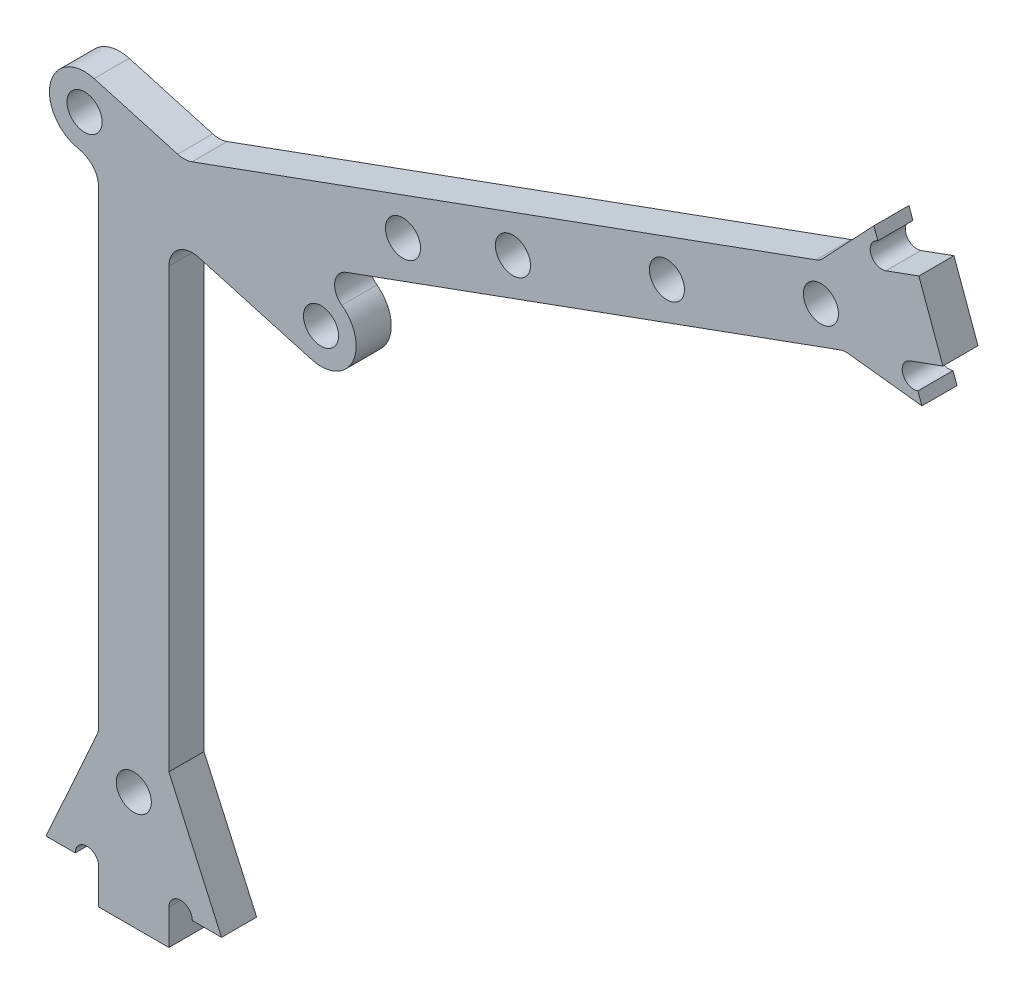
from build123d import *

# Parameters (mm, degrees)
SKETCH_1_R          = 1.5
EXTRUDE_1_DEPTH     = 3
FILLET_1_R          = 2
FILLET_2_R          = 1.5
EXTRUDE_2_DEPTH     = 3
CUT_EXTRUDE_2_DEPTH = 10
EXTRUDE_3_DEPTH     = 3
FILLET_4_R          = 1.5
SKETCH_8_R          = 1.5
CUT_EXTRUDE_3_DEPTH = 3
SKETCH_9_R          = 1
CUT_EXTRUDE_4_DEPTH = 10
SKETCH_10_R         = 1.5
CUT_EXTRUDE_5_DEPTH = 10
SKETCH_11_R         = 1.5
CUT_EXTRUDE_6_DEPTH = 75.756148202


with BuildPart() as part:
    # 草图1 → 凸台-拉伸1 (new body)
    with BuildSketch(Plane.XY):
        with BuildLine():
            ThreePointArc((-0.817087424, -2.886584165), (2.886584165, -0.817087424), (0.817087424, 2.886584165))
            Line((0.817087424, 2.886584165), (-1.760091504, 3.616090173))
            Line((-1.760091504, 3.616090173), (64.410402882, 27.700180516))
            Line((64.410402882, 27.700180516), (62.358282022, 33.338336241))
            Line((62.358282022, 33.338336241), (-11.628300128, 6.409422603))
            Line((-11.628300128, 6.409422603), (-19.389001732, 8.606196131))
            ThreePointArc((-19.389001732, 8.606196131), (-23.09267332, 6.53669939), (-21.023176579, 2.833027801))
            Line((-21.023176579, 2.833027801), (-19, 2.260339792))
            Line((-19, 2.260339792), (-19, -52.5))
            Line((-19, -52.5), (-13, -52.5))
            Line((-13, -52.5), (-13, 0.561957115))
            Line((-13, 0.561957115), (-0.817087424, -2.886584165))
        make_face()
        with Locations((-20.206089155, 5.719611966)):
            Circle(SKETCH_1_R, mode=Mode.SUBTRACT)
        Circle(SKETCH_1_R, mode=Mode.SUBTRACT)
    extrude(amount=EXTRUDE_1_DEPTH)

    # 圆角1
    fillet_1_edges = [part.edges().sort_by_distance(p)[0] for p in [
        (-11.628300128, 6.409422603, 1.5),
        (-13, 0.561957115, 1.5),
        (-19, 2.260339792, 1.5),
    ]]
    fillet(fillet_1_edges, radius=FILLET_1_R)

    # 圆角2
    fillet_2_edges = [part.edges().sort_by_distance(p)[0] for p in [
        (-1.760091504, 3.616090173, 1.5),
    ]]
    fillet(fillet_2_edges, radius=FILLET_2_R)

    # 草图3 → 凸台-拉伸2 (add)
    with BuildSketch(Plane.XY.offset(3)):
        with BuildLine():
            Line((-21, -49.5), (-23.5, -49.5))
            Line((-23.5, -49.5), (-19, -39.5))
            Line((-19, -39.5), (-19, -49.5))
            ThreePointArc((-19, -49.5), (-20, -48.5), (-21, -49.5))
        make_face()
        with BuildLine():
            Line((-13, -49.5), (-13, -39.5))
            Line((-13, -39.5), (-8.5, -49.5))
            Line((-8.5, -49.5), (-11, -49.5))
            ThreePointArc((-11, -49.5), (-12, -48.5), (-13, -49.5))
        make_face()
    extrude(amount=-EXTRUDE_2_DEPTH)

    # 草图7 → 切除-拉伸2 (cut)
    with BuildSketch(Plane.XY.offset(3)):
        Polygon((53.134091432, 23.595938796), (64.410402882, 27.700180516), (62.358282022, 33.338336241), (51.081970572, 29.234094521), align=None)
    extrude(amount=-CUT_EXTRUDE_2_DEPTH, mode=Mode.SUBTRACT)

    # 草图4 → 凸台-拉伸3 (add)
    with BuildSketch(Plane.XY.offset(3)):
        Polygon((42.624736985, 26.155913231), (47.23683228, 31.027111953), (48.26289271, 28.208034091), (51.081970572, 29.234094521), (53.134091432, 23.595938796), (50.31501357, 22.569878366), (51.341074, 19.750800504), (44.676857845, 20.517757506), align=None)
    extrude(amount=-EXTRUDE_3_DEPTH)

    # 圆角4
    fillet_4_edges = [part.edges().sort_by_distance(p)[0] for p in [
        (44.676857845, 20.517757506, 1.5),
        (42.624736985, 26.155913231, 1.5),
        (-19, -39.5, 1.5),
    ]]
    fillet(fillet_4_edges, radius=FILLET_4_R)

    # 草图8 → 切除-拉伸3 (cut)
    with BuildSketch(Plane.XY.offset(3)):
        with Locations((42.711104794, 22.994815225)):
            Circle(SKETCH_8_R)
    extrude(amount=-CUT_EXTRUDE_3_DEPTH, mode=Mode.SUBTRACT)

    # 草图9 → 切除-拉伸4 (cut)
    with BuildSketch(Plane.XY.offset(3)):
        with Locations((47.920872567, 29.147726712)):
            Circle(SKETCH_9_R)
        with Locations((50.657033713, 21.630185745)):
            Circle(SKETCH_9_R)
    extrude(amount=-CUT_EXTRUDE_4_DEPTH, mode=Mode.SUBTRACT)

    # 草图10 → 切除-拉伸5 (cut)
    with BuildSketch(Plane.XY.offset(3)):
        with Locations((-16, -42.5)):
            Circle(SKETCH_10_R)
    extrude(amount=-CUT_EXTRUDE_5_DEPTH, mode=Mode.SUBTRACT)

    # 草图11 → 切除-拉伸6 (cut, through all)
    with BuildSketch(Plane.XY.offset(3)):
        with Locations((16.399711412, 13.418251212)):
            Circle(SKETCH_11_R)
        with Locations((7.002785205, 9.998049779)):
            Circle(SKETCH_11_R)
        with Locations((29.555408103, 18.206533219)):
            Circle(SKETCH_11_R)
    extrude(amount=-CUT_EXTRUDE_6_DEPTH, mode=Mode.SUBTRACT)


solid = part.part
